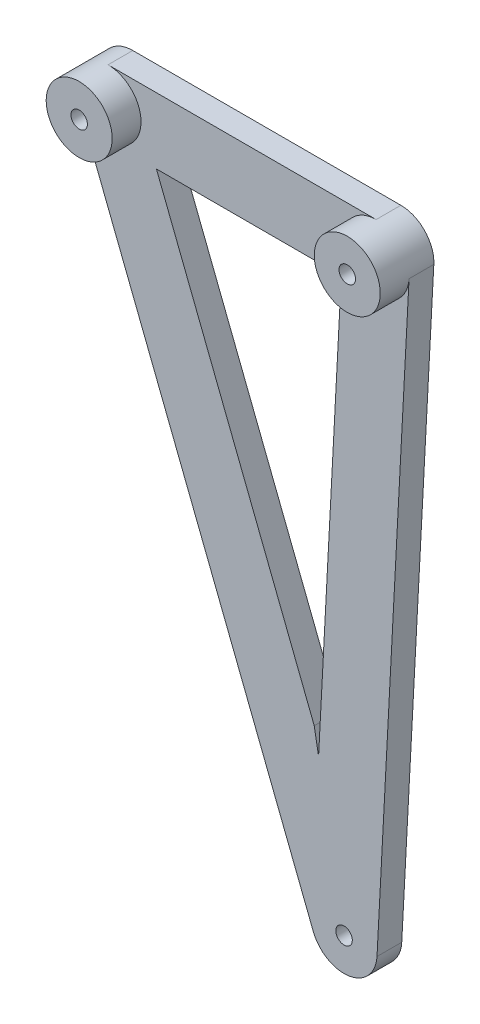
from build123d import *
from build123d.topology import SkipClean

# Parameters (mm, degrees)
SKETCH_1_R          = 1
EXTRUDE_1_DEPTH     = 3
SKETCH_2_R          = 1
EXTRUDE_2_DEPTH     = 3
EXTRUDE_START       = -3
SKETCH_2_5_R        = 1
EXTRUDE_4_DEPTH     = 3.5
SKETCH_1_6_R        = 1.75
CUT_EXTRUDE_2_DEPTH = 4.5


with BuildPart() as part:
    # 草图1 → 凸台-拉伸1 (new body)
    with BuildSketch(Plane.XY):
        with BuildLine():
            Line((-16.25, -32.145825623), (16.25, -32.145825623))
            ThreePointArc((16.25, -32.145825623), (20.25, -28.145825623), (16.25, -24.145825623))
            Line((16.25, -24.145825623), (0, -24.145825623))
            Line((0, -24.145825623), (-16.25, -24.145825623))
            ThreePointArc((-16.25, -24.145825623), (-20.25, -28.145825623), (-16.25, -32.145825623))
        make_face()
        with Locations((-16.25, -28.145825623)):
            Circle(SKETCH_1_R, mode=Mode.SUBTRACT)
        with Locations((16.25, -28.145825623)):
            Circle(SKETCH_1_R, mode=Mode.SUBTRACT)
    extrude(amount=EXTRUDE_1_DEPTH)

    # 草图2 → 凸台-拉伸2 (add)
    with BuildSketch(Plane(origin=(0, 0, 0), x_dir=(-1, 0, 0), z_dir=(0, 0, -1))):
        with BuildLine():
            ThreePointArc((-16.356032043, -101.464832065), (-12.998767478, -105.201322829), (-8.636789042, -102.71019202))
            Line((-8.636789042, -102.71019202), (19.97488875, -29.603633498))
            ThreePointArc((19.97488875, -29.603633498), (14.792192125, -31.870714373), (12.52511125, -26.688017748))
            Line((12.52511125, -26.688017748), (-8.745712257, -81.037738685))
            Line((-8.745712257, -81.037738685), (-9.274078909, -83.991512561))
            Line((-9.274078909, -83.991512561), (-12.255645749, -27.933377702))
            ThreePointArc((-12.255645749, -27.933377702), (-16.037552079, -32.140179874), (-20.244354251, -28.358273544))
            Line((-20.244354251, -28.358273544), (-16.356032043, -101.464832065))
        make_face()
        with Locations((-12.361677792, -101.252384145)):
            Circle(SKETCH_2_R, mode=Mode.SUBTRACT)
    extrude(amount=-EXTRUDE_2_DEPTH)

    # 草图2<5> → 凸台-拉伸4 (add)
    # profile 1 of 2: a face of its own
    with SkipClean():  # the faces are left unmerged after this step: merging them gives an invalid solid
        with BuildSketch(Plane(origin=(0, 0, 0), x_dir=(-1, 0, 0), z_dir=(0, 0, -1)).offset(EXTRUDE_START)):
            with BuildLine():
                ThreePointArc((-16.25, -24.145825623), (-19.152567112, -25.393534912), (-20.244354251, -28.358273544))
                ThreePointArc((-20.244354251, -28.358273544), (-19.002290711, -31.048392735), (-16.25, -32.145825623))
                ThreePointArc((-16.25, -32.145825623), (-13.421572875, -30.974252748), (-12.25, -28.145825623))
                ThreePointArc((-12.25, -28.145825623), (-12.251411686, -28.039564161), (-12.255645749, -27.933377702))
                ThreePointArc((-12.255645749, -27.933377702), (-13.497709289, -25.243258511), (-16.25, -24.145825623))
            make_face()
            with Locations(Location((-16.25, -28.145825623, 0), (0, 0, 180))):
                Circle(SKETCH_2_5_R, mode=Mode.SUBTRACT)
        # profile 2 of 2: a face of its own
        with BuildSketch(Plane(origin=(0, 0, 0), x_dir=(-1, 0, 0), z_dir=(0, 0, -1)).offset(EXTRUDE_START)):
            with BuildLine():
                ThreePointArc((16.25, -32.145825623), (18.504857922, -31.449704518), (19.97488875, -29.603633498))
                ThreePointArc((19.97488875, -29.603633498), (20.180620498, -28.887595466), (20.25, -28.145825623))
                ThreePointArc((20.25, -28.145825623), (19.078427125, -25.317398498), (16.25, -24.145825623))
                ThreePointArc((16.25, -24.145825623), (13.995142078, -24.841946728), (12.52511125, -26.688017748))
                ThreePointArc((12.52511125, -26.688017748), (12.946121105, -30.400683545), (16.25, -32.145825623))
            make_face()
            with Locations(Location((16.25, -28.145825623, 0), (0, 0, 180))):
                Circle(SKETCH_2_5_R, mode=Mode.SUBTRACT)
        extrude(amount=-EXTRUDE_4_DEPTH)

    # 草图1<6> → 切除-拉伸2 (cut)
    with SkipClean():  # the faces are left unmerged after this step: merging them gives an invalid solid
        with BuildSketch(Plane.XY):
            with Locations((-16.25, -28.145825623)):
                Circle(SKETCH_1_6_R)
            with Locations((16.25, -28.145825623)):
                Circle(SKETCH_1_6_R)
        extrude(amount=CUT_EXTRUDE_2_DEPTH, mode=Mode.SUBTRACT)


solid = part.part
